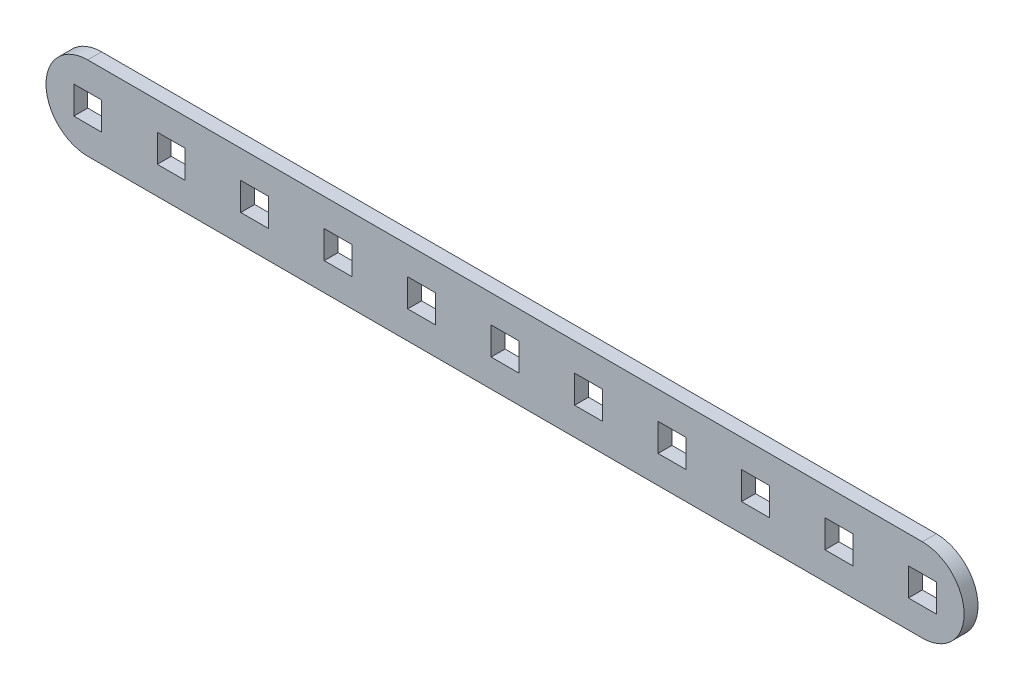
from build123d import *

# Parameters (mm, degrees)
MODEL_W                 = 3
MODEL_H                 = 3
SALIENTE_EXTRUIR1_DEPTH = 1.5


with BuildPart() as part:
    # Model → Saliente-Extruir1 (new body)
    with BuildSketch(Plane.XY):
        with BuildLine():
            Line((9.904781567, 296.774995526), (99.904781567, 296.774995526))
            ThreePointArc((99.904781567, 296.774995526), (104.404781567, 292.274995526), (99.904781567, 287.774995526))
            Line((99.904781567, 287.774995526), (9.904781567, 287.774995526))
            ThreePointArc((9.904781567, 287.774995526), (5.404781567, 292.274995526), (9.904781567, 296.774995526))
        make_face()
        with Locations((9.904781567, 292.274995526)):
            Rectangle(MODEL_W, MODEL_H, mode=Mode.SUBTRACT)
        with Locations((18.904781567, 292.274995526)):
            Rectangle(MODEL_W, MODEL_H, mode=Mode.SUBTRACT)
        with Locations((27.904781567, 292.274995526)):
            Rectangle(MODEL_W, MODEL_H, mode=Mode.SUBTRACT)
        with Locations((36.904781567, 292.274995526)):
            Rectangle(MODEL_W, MODEL_H, mode=Mode.SUBTRACT)
        with Locations((45.904781567, 292.274995526)):
            Rectangle(MODEL_W, MODEL_H, mode=Mode.SUBTRACT)
        with Locations((54.904781567, 292.274995526)):
            Rectangle(MODEL_W, MODEL_H, mode=Mode.SUBTRACT)
        with Locations((63.904781567, 292.274995526)):
            Rectangle(MODEL_W, MODEL_H, mode=Mode.SUBTRACT)
        with Locations((72.904781567, 292.274995526)):
            Rectangle(MODEL_W, MODEL_H, mode=Mode.SUBTRACT)
        with Locations((81.904781567, 292.274995526)):
            Rectangle(MODEL_W, MODEL_H, mode=Mode.SUBTRACT)
        with Locations((90.904781567, 292.274995526)):
            Rectangle(MODEL_W, MODEL_H, mode=Mode.SUBTRACT)
        with Locations((99.904781567, 292.274995526)):
            Rectangle(MODEL_W, MODEL_H, mode=Mode.SUBTRACT)
    extrude(amount=SALIENTE_EXTRUIR1_DEPTH)


solid = part.part
